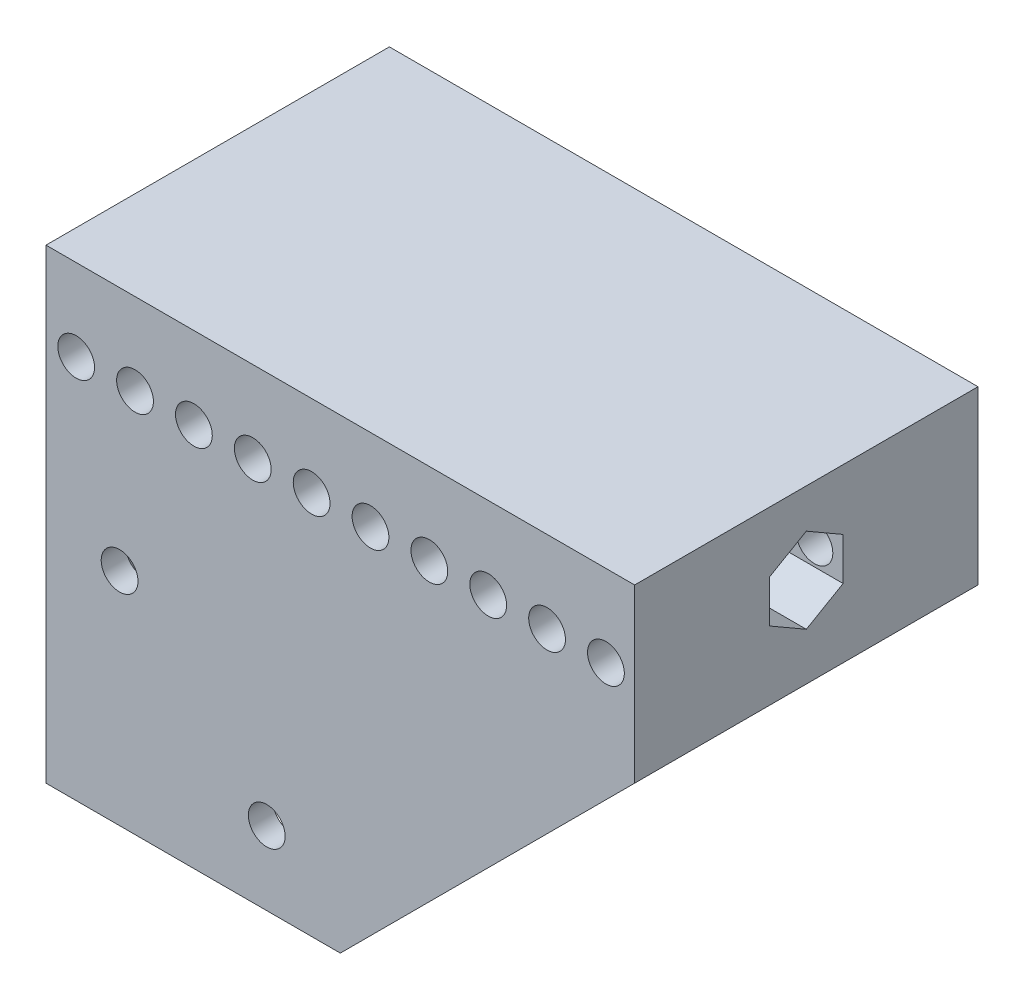
from build123d import *

# Parameters (mm, degrees)
BOSS_EXTRUDE1_DEPTH     = 3.175
SKETCH2_W               = 3.175
SKETCH2_H               = 38.1
BOSS_EXTRUDE2_DEPTH     = 41.275
SKETCH3_W               = 44.45
SKETCH3_H               = 22.225
BOSS_EXTRUDE3_DEPTH     = 76.2
SCALE1_SCALE            = 1.333333333
CUT_EXTRUDE2_DEPTH      = 132.738543571
CUT_EXTRUDE2_DEPTH_BACK = 132.738543571
CUT_EXTRUDE3_DEPTH      = 127.255434571
CUT_EXTRUDE3_DEPTH_BACK = 127.255434571
SKETCH6_R               = 3.175
CUT_EXTRUDE4_DEPTH      = 132.738543571
CUT_EXTRUDE4_DEPTH_BACK = 132.738543571
SKETCH7_R               = 3.175
CUT_EXTRUDE5_DEPTH      = 118.143916866
CUT_EXTRUDE5_DEPTH_BACK = 118.143916866
SKETCH8_R               = 3.175


with BuildPart() as part:
    # Sketch1 → Boss-Extrude1 (new body)
    with BuildSketch(Plane.XY):
        Polygon((0, 0), (38.1, 0), (76.2, 38.1), (0, 38.1), align=None)
    boss_extrude1 = extrude(amount=BOSS_EXTRUDE1_DEPTH)

    # Sketch2 → Boss-Extrude2 (add)
    with BuildSketch(Plane.XY.offset(3.175)):
        with Locations((1.5875, 19.05)):
            Rectangle(SKETCH2_W, SKETCH2_H)
    extrude(amount=BOSS_EXTRUDE2_DEPTH)

    # Mirror1: Boss-Extrude1 across plane
    add(boss_extrude1.mirror(Plane.XY.offset(22.225)))

    # Sketch3 → Boss-Extrude3 (add)
    with BuildSketch(Plane.ZY):
        with Locations((22.225, 49.2125)):
            Rectangle(SKETCH3_W, SKETCH3_H)
    extrude(amount=-BOSS_EXTRUDE3_DEPTH)


with BuildPart() as part_1:
    # Scale1: scaled about (35.055122951, 43.591188525, 22.225)
    add(part.part.scale(SCALE1_SCALE).moved(Location((-11.685040984, -14.530396175, -7.408333333))))

    # Sketch5 → Cut-Extrude2 (cut, two sides: drawn at the far end of the back side and taken through both)
    with BuildSketch(Plane.ZY.offset(11.685040984).offset(-CUT_EXTRUDE2_DEPTH_BACK)):
        Polygon((28.575, 55.461540547), (22.225, 59.127714756), (15.875, 55.461540547), (15.875, 48.129192128), (22.225, 44.463017919), (28.575, 48.129192128), align=None)
    extrude(amount=CUT_EXTRUDE2_DEPTH + CUT_EXTRUDE2_DEPTH_BACK, mode=Mode.SUBTRACT)

    # Sketch6 → Cut-Extrude3 (cut, two sides: drawn at the far end of the back side and taken through both)
    with BuildSketch(Plane(origin=(0, 0, -7.408333333), x_dir=(-1, 0, 0), z_dir=(0, 0, -1)).offset(-CUT_EXTRUDE3_DEPTH_BACK)):
        with Locations((-1.014959016, 23.569603825)):
            Circle(SKETCH6_R)
        with Locations((-26.414959016, -1.830396175)):
            Circle(SKETCH6_R)
    extrude(amount=CUT_EXTRUDE3_DEPTH + CUT_EXTRUDE3_DEPTH_BACK, mode=Mode.SUBTRACT)

    # Sketch7 → Cut-Extrude4 (cut, two sides: drawn at the far end of the back side and taken through both)
    with BuildSketch(Plane.ZY.offset(11.685040984).offset(-CUT_EXTRUDE4_DEPTH_BACK)):
        with Locations(Location((7.408333333, 24.386762915, 0), (0, 0, 270))):
            Circle(SKETCH7_R)
        with Locations(Location((37.041666667, -1.830396175, 0), (0, 0, 270))):
            Circle(SKETCH7_R)
    extrude(amount=CUT_EXTRUDE4_DEPTH + CUT_EXTRUDE4_DEPTH_BACK, mode=Mode.SUBTRACT)

    # Sketch8 → Cut-Extrude5 (cut, two sides: drawn at the far end of the back side and taken through both)
    with BuildSketch(Plane(origin=(0, 0, 28.575), x_dir=(-1, 0, 0), z_dir=(0, 0, -1)).offset(-CUT_EXTRUDE5_DEPTH_BACK)):
        with Locations(Location((-84.962592617, 51.795366338, 0), (0, 0, 90))):
            Circle(SKETCH8_R)
        with Locations(Location((-74.802592617, 51.795366338, 0), (0, 0, 90))):
            Circle(SKETCH8_R)
        with Locations(Location((-64.642592617, 51.795366338, 0), (0, 0, 90))):
            Circle(SKETCH8_R)
        with Locations(Location((-54.482592617, 51.795366338, 0), (0, 0, 90))):
            Circle(SKETCH8_R)
        with Locations(Location((-44.322592617, 51.795366338, 0), (0, 0, 90))):
            Circle(SKETCH8_R)
        with Locations(Location((-34.162592617, 51.795366338, 0), (0, 0, 90))):
            Circle(SKETCH8_R)
        with Locations(Location((-24.002592617, 51.795366338, 0), (0, 0, 90))):
            Circle(SKETCH8_R)
        with Locations(Location((-13.842592617, 51.795366338, 0), (0, 0, 90))):
            Circle(SKETCH8_R)
        with Locations(Location((-3.682592617, 51.795366338, 0), (0, 0, 90))):
            Circle(SKETCH8_R)
        with Locations(Location((6.477407383, 51.795366338, 0), (0, 0, 90))):
            Circle(SKETCH8_R)
    extrude(amount=CUT_EXTRUDE5_DEPTH + CUT_EXTRUDE5_DEPTH_BACK, mode=Mode.SUBTRACT)


solid = part_1.part
